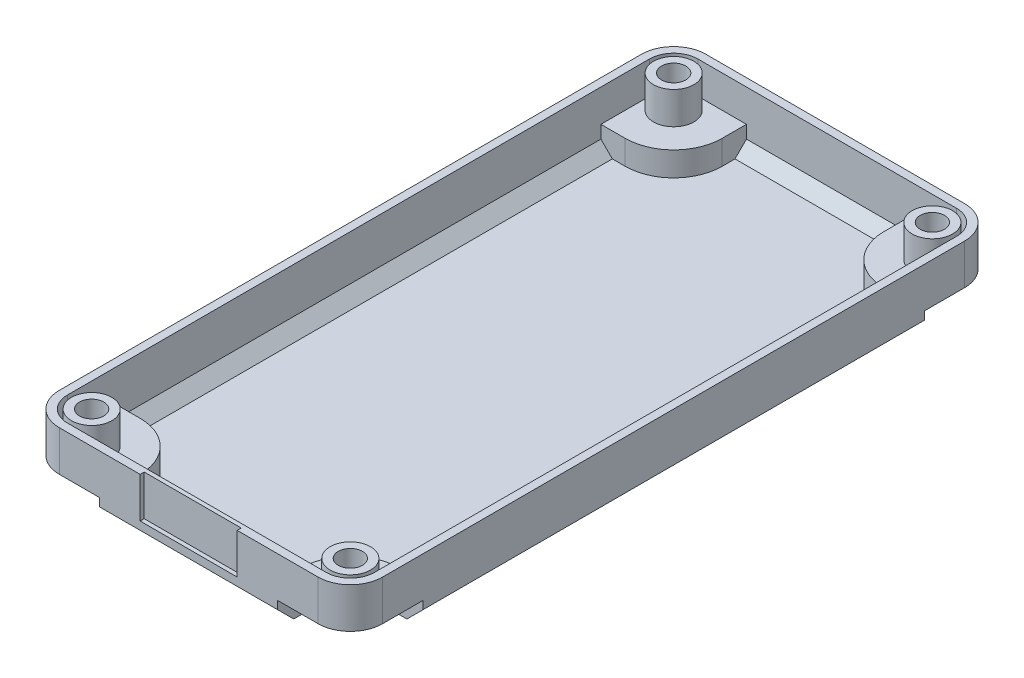
from build123d import *

# Parameters (mm, degrees)
ESQUISSE1_W                     = 20
ESQUISSE1_H                     = 40
BOSS_EXTRU_1_DEPTH              = 4
ESQUISSE2_W                     = 19
ESQUISSE2_H                     = 39
ENL_V_MAT_EXTRU_1_DEPTH         = 3.5
ESQUISSE3_W                     = 4.5
ESQUISSE3_H                     = 1.5
BOSS_EXTRU_2_DEPTH              = 4.5
ESQUISSE4_W                     = 4.5
ESQUISSE4_H                     = 1.5
BOSS_EXTRU_3_DEPTH              = 4.5
ESQUISSE5_W                     = 4.5
ESQUISSE5_H                     = 1.5
BOSS_EXTRU_4_DEPTH              = 4.5
ESQUISSE6_W                     = 4.5
ESQUISSE6_H                     = 1.5
BOSS_EXTRU_5_DEPTH              = 4.5
ESQUISSE7_W                     = 4.5
ESQUISSE7_H                     = 1.5
ENL_V_MAT_EXTRU_2_DEPTH         = 4.5
ESQUISSE8_W                     = 4.5
ESQUISSE8_H                     = 1.5
ENL_V_MAT_EXTRU_3_DEPTH         = 4.5
ESQUISSE9_W                     = 4.5
ESQUISSE9_H                     = 1.5
ENL_V_MAT_EXTRU_4_DEPTH         = 4.5
ESQUISSE10_W                    = 4.5
ESQUISSE10_H                    = 1.5
ENL_V_MAT_EXTRU_5_DEPTH         = 4.5
ESQUISSE11_W                    = 6
ESQUISSE11_H                    = 2.5
ENL_V_MAT_EXTRU_6_DEPTH         = 0.25
ESQUISSE12_W                    = 1.25
ESQUISSE12_H                    = 2
ESQUISSE13_W                    = 1.25
ESQUISSE13_H                    = 2
ESQUISSE14_W                    = 1.25
ESQUISSE14_H                    = 2
ESQUISSE15_W                    = 1.25
ESQUISSE15_H                    = 2
DIAM_TRE_DU_PER_AGE_1_5_1_5_1_D = 1.5
CHANFREIN1_SIZE                 = 0.707106781
CHANFREIN2_SIZE                 = 1
CONG_1_R                        = 1.5
CONG_2_R                        = 2
CONG_3_R                        = 2.5
CONG_4_R                        = 3


with BuildPart() as part:
    # Esquisse1 → Boss.-Extru.1 (new body)
    with BuildSketch(Plane(origin=(0, 0, 0), x_dir=(1, 0, 0), z_dir=(0, 1, 0))):
        with Locations((22.084435946, -33.026080306)):
            Rectangle(ESQUISSE1_W, ESQUISSE1_H)
    extrude(amount=-BOSS_EXTRU_1_DEPTH)

    # Esquisse2 → Enlèv. mat.-Extru.1 (cut)
    with BuildSketch(Plane(origin=(0, 0, 0), x_dir=(-1, 0, 0), z_dir=(0, 1, 0))):
        with Locations((-22.084435946, 33.026080306)):
            Rectangle(ESQUISSE2_W, ESQUISSE2_H)
    extrude(amount=-ENL_V_MAT_EXTRU_1_DEPTH, mode=Mode.SUBTRACT)

    # Esquisse3 → Boss.-Extru.2 (add)
    with BuildSketch(Plane(origin=(12.584435946, 0, 0), x_dir=(0, 0, -1), z_dir=(1, 0, 0))):
        with Locations((-15.776080306, -2.75)):
            Rectangle(ESQUISSE3_W, ESQUISSE3_H)
    extrude(amount=BOSS_EXTRU_2_DEPTH)

    # Esquisse4 → Boss.-Extru.3 (add)
    with BuildSketch(Plane.XY.offset(13.526080306)):
        with Locations((29.334435946, -2.75)):
            Rectangle(ESQUISSE4_W, ESQUISSE4_H)
    extrude(amount=BOSS_EXTRU_3_DEPTH)

    # Esquisse5 → Boss.-Extru.4 (add)
    with BuildSketch(Plane(origin=(12.584435946, 0, 0), x_dir=(0, 0, -1), z_dir=(1, 0, 0))):
        with Locations((-50.276080306, -2.75)):
            Rectangle(ESQUISSE5_W, ESQUISSE5_H)
    extrude(amount=BOSS_EXTRU_4_DEPTH)

    # Esquisse6 → Boss.-Extru.5 (add)
    with BuildSketch(Plane(origin=(0, 0, 52.526080306), x_dir=(-1, 0, 0), z_dir=(0, 0, -1))):
        with Locations((-29.334435946, -2.75)):
            Rectangle(ESQUISSE6_W, ESQUISSE6_H)
    extrude(amount=BOSS_EXTRU_5_DEPTH)

    # Esquisse7 → Enlèv. mat.-Extru.2 (cut)
    with BuildSketch(Plane.ZY.offset(-12.084435946)):
        with Locations((15.276080306, -3.25)):
            Rectangle(ESQUISSE7_W, ESQUISSE7_H)
    extrude(amount=-ENL_V_MAT_EXTRU_2_DEPTH, mode=Mode.SUBTRACT)

    # Esquisse8 → Enlèv. mat.-Extru.3 (cut)
    with BuildSketch(Plane(origin=(0, 0, 13.026080306), x_dir=(-1, 0, 0), z_dir=(0, 0, -1))):
        with Locations((-29.834435946, -3.25)):
            Rectangle(ESQUISSE8_W, ESQUISSE8_H)
    extrude(amount=-ENL_V_MAT_EXTRU_3_DEPTH, mode=Mode.SUBTRACT)

    # Esquisse9 → Enlèv. mat.-Extru.4 (cut)
    with BuildSketch(Plane.ZY.offset(-12.084435946)):
        with Locations((50.776080306, -3.25)):
            Rectangle(ESQUISSE9_W, ESQUISSE9_H)
    extrude(amount=-ENL_V_MAT_EXTRU_4_DEPTH, mode=Mode.SUBTRACT)

    # Esquisse10 → Enlèv. mat.-Extru.5 (cut)
    with BuildSketch(Plane(origin=(32.084435946, 0, 0), x_dir=(0, 0, -1), z_dir=(1, 0, 0))):
        with Locations((-50.776080306, -3.25)):
            Rectangle(ESQUISSE10_W, ESQUISSE10_H)
    extrude(amount=-ENL_V_MAT_EXTRU_5_DEPTH, mode=Mode.SUBTRACT)

    # Esquisse11 → Enlèv. mat.-Extru.6 (cut)
    with BuildSketch(Plane.XY.offset(53.026080306)):
        with Locations((22.084435946, -1.25)):
            Rectangle(ESQUISSE11_W, ESQUISSE11_H)
    extrude(amount=-ENL_V_MAT_EXTRU_6_DEPTH, mode=Mode.SUBTRACT)

    # Esquisse12 → Révolution1 (revolve)
    with BuildSketch(Plane.XY.offset(15.026080306)):
        with Locations((30.709435946, -1)):
            Rectangle(ESQUISSE12_W, ESQUISSE12_H)
    revolve(axis=Axis((30.084435946, 0, 15.026080306), (0, -1, 0)))

    # Esquisse13 → Révolution2 (revolve)
    with BuildSketch(Plane.XY.offset(15.026080306)):
        with Locations((14.709435946, -1)):
            Rectangle(ESQUISSE13_W, ESQUISSE13_H)
    revolve(axis=Axis((14.084435946, 0, 15.026080306), (0, -1, 0)))

    # Esquisse14 → Révolution3 (revolve)
    with BuildSketch(Plane.XY.offset(51.026080306)):
        with Locations((14.709435946, -1)):
            Rectangle(ESQUISSE14_W, ESQUISSE14_H)
    revolve(axis=Axis((14.084435946, 0, 51.026080306), (0, -1, 0)))

    # Esquisse15 → Révolution4 (revolve)
    with BuildSketch(Plane.XY.offset(51.026080306)):
        with Locations((30.709435946, -1)):
            Rectangle(ESQUISSE15_W, ESQUISSE15_H)
    revolve(axis=Axis((30.084435946, 0, 51.026080306), (0, -1, 0)))

    # Diamètre du perçage Ø1.5 (1.5)1 (through all)
    with Locations(Plane(origin=(0, -2.5, 0), x_dir=(-1, 0, 0), z_dir=(0, -1, 0))):
        with Locations((-30.084435946, -51.026080306), (-14.084435946, -51.026080306), (-14.084435946, -15.026080306), (-30.084435946, -15.026080306)):
            Hole(DIAM_TRE_DU_PER_AGE_1_5_1_5_1_D / 2)

    # Chanfrein1
    chanfrein1_edges = [part.edges().sort_by_distance(p)[0] for p in [
        (12.584435946, -3.5, 33.026080306),
        (22.084435946, -3.5, 52.526080306),
        (22.084435946, -3.5, 13.526080306),
        (31.584435946, -3.5, 33.026080306),
    ]]
    chamfer(chanfrein1_edges, length=CHANFREIN1_SIZE)

    # Chanfrein2
    chanfrein2_edges = [part.edges().sort_by_distance(p)[0] for p in [
        (12.084435946, -4, 33.026080306),
        (22.084435946, -4, 53.026080306),
        (22.084435946, -4, 13.026080306),
        (32.084435946, -4, 33.026080306),
    ]]
    chamfer(chanfrein2_edges, length=CHANFREIN2_SIZE)

    # Congé1
    cong_1_edges = [part.edges().sort_by_distance(p)[0] for p in [
        (12.584435946, -1, 13.526080306),
        (31.584435946, -1, 13.526080306),
        (31.584435946, -1, 52.526080306),
        (12.584435946, -1, 52.526080306),
    ]]
    fillet(cong_1_edges, radius=CONG_1_R)

    # Congé2
    cong_2_edges = [part.edges().sort_by_distance(p)[0] for p in [
        (12.084435946, -1.25, 53.026080306),
        (32.084435946, -1.25, 53.026080306),
        (32.084435946, -1.25, 13.026080306),
        (12.084435946, -1.25, 13.026080306),
    ]]
    fillet(cong_2_edges, radius=CONG_2_R)

    # Congé3
    cong_3_edges = [part.edges().sort_by_distance(p)[0] for p in [
        (16.584435946, -3.25, 17.526080306),
        (27.584435946, -3.25, 48.526080306),
        (16.584435946, -3.25, 48.526080306),
        (27.584435946, -3.25, 17.526080306),
    ]]
    fillet(cong_3_edges, radius=CONG_3_R)

    # Congé4
    cong_4_edges = [part.edges().sort_by_distance(p)[0] for p in [
        (17.084435946, -2.75, 18.026080306),
        (17.084435946, -2.75, 48.026080306),
        (27.084435946, -2.75, 18.026080306),
        (27.084435946, -2.75, 48.026080306),
    ]]
    fillet(cong_4_edges, radius=CONG_4_R)


solid = part.part
